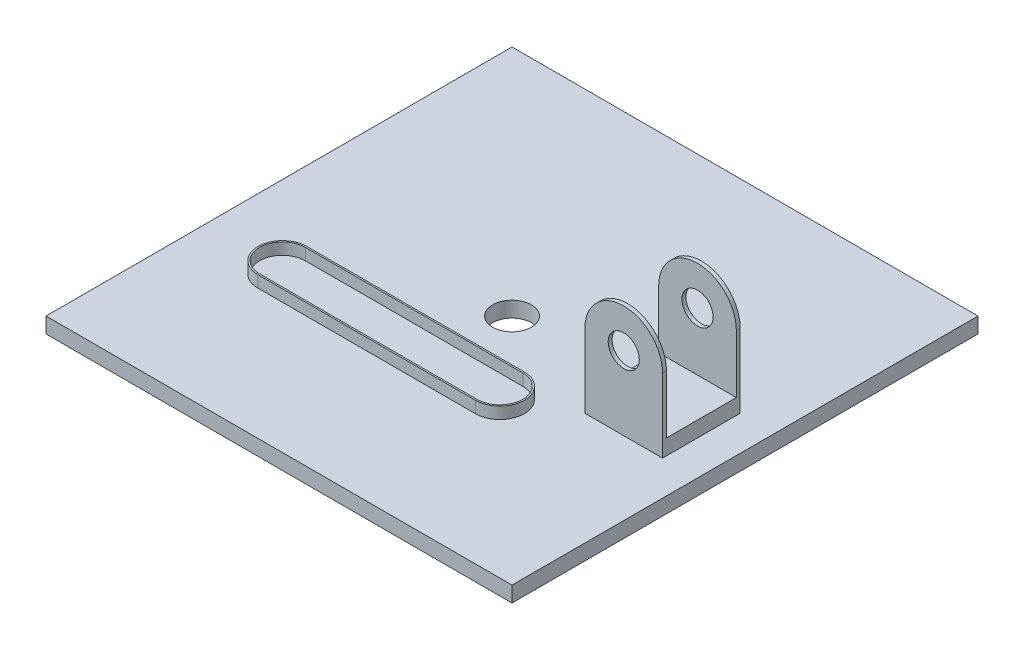
from build123d import *

# Parameters (mm, degrees)
SKETCH_1_W          = 600
SKETCH_1_H          = 600
EXTRUDE_1_DEPTH     = 20
SKETCH_2_W          = 100
SKETCH_2_H          = 100
EXTRUDE_2_DEPTH     = 20
SKETCH_3_R          = 20
EXTRUDE_3_DEPTH     = 5
EXTRUDE_START       = -5
SKETCH_5_R          = 20
EXTRUDE_4_DEPTH     = 5
EXTRUDE_1_2_DEPTH   = 15
SKETCH_7_R          = 25
CUT_EXTRUDE_1_DEPTH = 20


with BuildPart() as part:
    # 草图1 → Extrude 1 (new body)
    with BuildSketch(Plane(origin=(0, 0, 0), x_dir=(1, 0, 0), z_dir=(0, 1, 0))):
        Rectangle(SKETCH_1_W, SKETCH_1_H)
    extrude(amount=EXTRUDE_1_DEPTH)

    # 草图2 → 凸台-拉伸2 (add)
    with BuildSketch(Plane(origin=(0, 20, 0), x_dir=(1, 0, 0), z_dir=(0, 1, 0))):
        with Locations((205.348971612, -11.468548329)):
            Rectangle(SKETCH_2_W, SKETCH_2_H)
    extrude(amount=EXTRUDE_2_DEPTH)

    # 草图3 → 凸台-拉伸3 (add)
    with BuildSketch(Plane.XY.offset(61.468548329)):
        with BuildLine():
            Line((255.348971612, 40), (255.348971612, 114.766543298))
            ThreePointArc((255.348971612, 114.766543298), (205.348971612, 164.766543298), (155.348971612, 114.766543298))
            Line((155.348971612, 114.766543298), (155.348971612, 40))
            Line((155.348971612, 40), (255.348971612, 40))
        make_face()
        with Locations((205.348971612, 114.766543298)):
            Circle(SKETCH_3_R, mode=Mode.SUBTRACT)
    extrude(amount=-EXTRUDE_3_DEPTH)

    # 草图5 → 凸台-拉伸4 (add)
    with BuildSketch(Plane(origin=(0, 0, -38.531451671), x_dir=(-1, 0, 0), z_dir=(0, 0, -1)).offset(EXTRUDE_START)):
        with BuildLine():
            ThreePointArc((-255.348971612, 114.766543298), (-205.348971612, 164.766543298), (-155.348971612, 114.766543298))
            Line((-155.348971612, 114.766543298), (-155.348971612, 40))
            Line((-155.348971612, 40), (-255.348971612, 40))
            Line((-255.348971612, 40), (-255.348971612, 114.766543298))
        make_face()
        with Locations(Location((-205.348971612, 114.766543298, 0), (0, 0, 180))):
            Circle(SKETCH_5_R, mode=Mode.SUBTRACT)
    extrude(amount=EXTRUDE_4_DEPTH)

    # 草图6 → Extrude 1 2 (add)
    with BuildSketch(Plane(origin=(0, 20, 0), x_dir=(1, 0, 0), z_dir=(0, 1, 0))):
        with BuildLine():
            Line((-194.645221659, -69.468548329), (85.354778341, -69.468548329))
            ThreePointArc((85.354778341, -69.468548329), (116.854778341, -100.968548329), (85.354778341, -132.468548329))
            Line((85.354778341, -132.468548329), (-194.645221659, -132.468548329))
            ThreePointArc((-194.645221659, -132.468548329), (-226.145221659, -100.968548329), (-194.645221659, -69.468548329))
        make_face()
        with BuildLine():
            Line((-194.645221659, -71.468548329), (85.354778341, -71.468548329))
            ThreePointArc((85.354778341, -71.468548329), (114.854778341, -100.968548329), (85.354778341, -130.468548329))
            Line((85.354778341, -130.468548329), (-194.645221659, -130.468548329))
            ThreePointArc((-194.645221659, -130.468548329), (-224.145221659, -100.968548329), (-194.645221659, -71.468548329))
        make_face(mode=Mode.SUBTRACT)
    extrude(amount=EXTRUDE_1_2_DEPTH)

    # 草图7 → 切除-拉伸1 (cut)
    with BuildSketch(Plane(origin=(0, 20, 0), x_dir=(1, 0, 0), z_dir=(0, 1, 0))):
        with Locations(Location((0, 0, 0), (0, 0, 270))):
            Circle(SKETCH_7_R)
    extrude(amount=-CUT_EXTRUDE_1_DEPTH, mode=Mode.SUBTRACT)


solid = part.part
